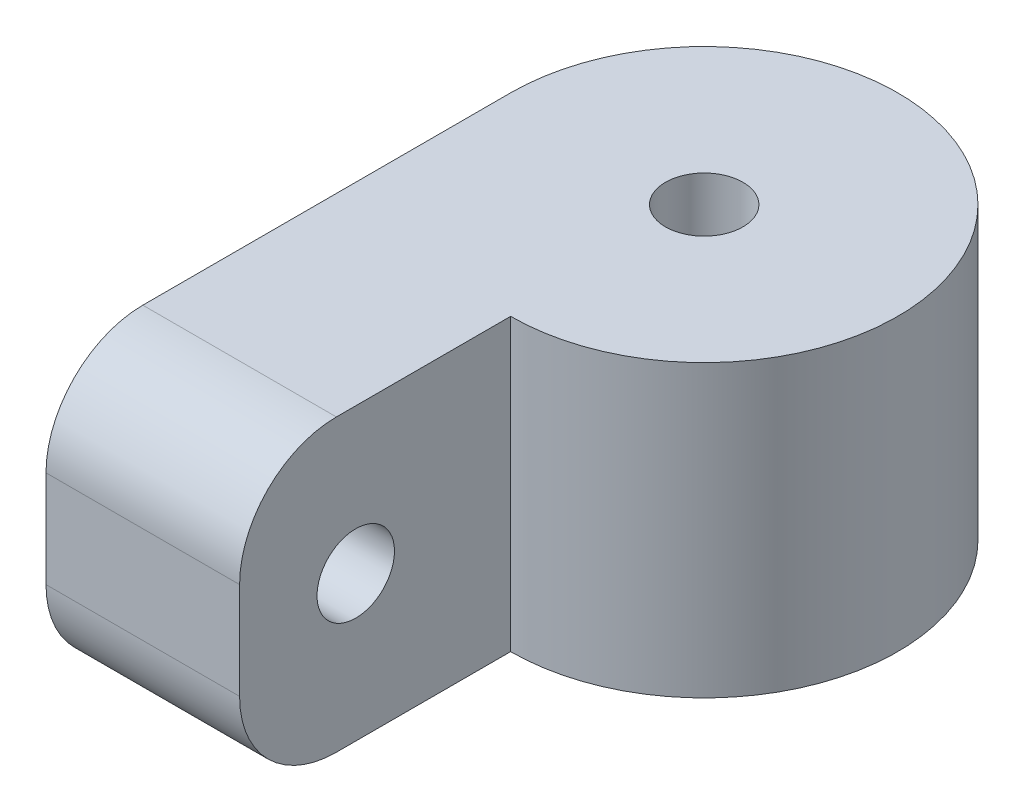
from build123d import *

# Parameters (mm, degrees)
SKIZZE1_R                       = 2
AUFSATZ_LINEAR_AUSTRAGEN1_DEPTH = 15
VERRUNDUNG1_R                   = 5
SKIZZE2_R                       = 2
SCHNITT_LINEAR_AUSTRAGEN1_DEPTH = 29.442925307


with BuildPart() as part:
    # Skizze1 → Aufsatz-Linear austragen1 (new body)
    with BuildSketch(Plane(origin=(0, 0, 0), x_dir=(1, 0, 0), z_dir=(0, 1, 0))):
        with BuildLine():
            Line((0, 12), (0, -12))
            Line((0, -12), (10, -12))
            Line((10, -12), (10, 2))
            ThreePointArc((10, 2), (17.071067812, 19.071067812), (0, 12))
        make_face()
        with Locations(Location((10, 12, 0), (0, 0, 270))):
            Circle(SKIZZE1_R, mode=Mode.SUBTRACT)
    extrude(amount=AUFSATZ_LINEAR_AUSTRAGEN1_DEPTH)

    # Verrundung1
    verrundung1_edges = [part.edges().sort_by_distance(p)[0] for p in [
        (5, 15, 12),
        (5, 0, 12),
    ]]
    fillet(verrundung1_edges, radius=VERRUNDUNG1_R)

    # Skizze2 → Schnitt-Linear austragen1 (cut, through all)
    with BuildSketch(Plane(origin=(10, 0, 0), x_dir=(0, 0, -1), z_dir=(1, 0, 0))):
        with Locations((-6, 7.5)):
            Circle(SKIZZE2_R)
    extrude(amount=-SCHNITT_LINEAR_AUSTRAGEN1_DEPTH, mode=Mode.SUBTRACT)


solid = part.part
